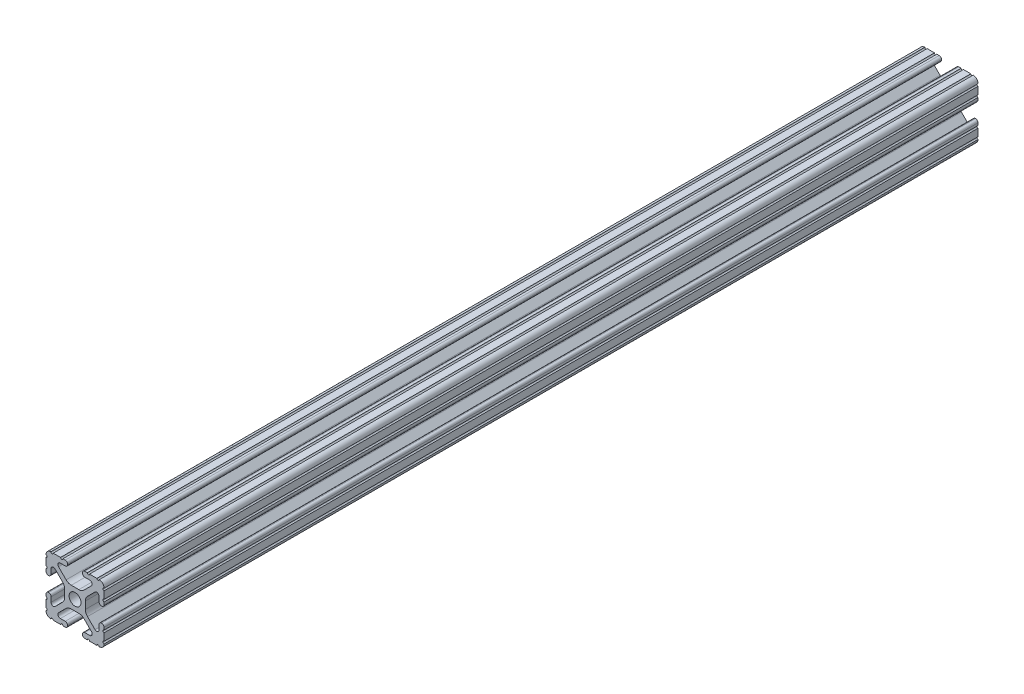
from build123d import *

# Parameters (mm, degrees)
SKETCH1_R           = 2.6035
BOSS_EXTRUDE1_DEPTH = 304.8
SKETCH2_W           = 33.577347781
SKETCH2_H           = 32.744851555
CUT_EXTRUDE1_DEPTH  = 227.33


with BuildPart() as part:
    # Sketch1 → Boss-Extrude1 (new, symmetric)
    with BuildSketch(Plane.XY):
        with BuildLine():
            Line((-7.179650497, -8.645192506), (-3.952270251, -5.423690499))
            ThreePointArc((-3.952270251, -5.423690499), (-2.922936451, -4.736929036), (-1.709253557, -4.4958))
            Line((-1.709253557, -4.4958), (1.709253557, -4.4958))
            ThreePointArc((1.709253557, -4.4958), (2.922936451, -4.736929036), (3.952270251, -5.423690499))
            Line((3.952270251, -5.423690499), (7.179650497, -8.645192506))
            ThreePointArc((7.179650497, -8.645192506), (7.41473083, -9.822813117), (6.416408329, -10.4902))
            Line((6.416408329, -10.4902), (4.287512407, -10.4902))
            ThreePointArc((4.287512407, -10.4902), (3.54574862, -10.79744862), (3.2385, -11.539212407))
            Line((3.2385, -11.539212407), (3.2385, -11.650987593))
            ThreePointArc((3.2385, -11.650987593), (3.54574862, -12.39275138), (4.287512407, -12.7))
            Line((4.287512407, -12.7), (5.317126718, -12.7))
            ThreePointArc((5.317126718, -12.7), (5.825126718, -12.192), (6.333126718, -12.7))
            Line((6.333126718, -12.7), (9.550443118, -12.7))
            ThreePointArc((9.550443118, -12.7), (10.058366869, -12.192000006), (10.566443095, -12.699847501))
            ThreePointArc((10.566443095, -12.699847501), (12.082537762, -12.08250727), (12.699846982, -10.566399977))
            ThreePointArc((12.699846982, -10.566399977), (12.192000006, -10.058323491), (12.7, -9.5504))
            Line((12.7, -9.5504), (12.7, -6.3330836))
            ThreePointArc((12.7, -6.3330836), (12.192, -5.8250836), (12.7, -5.3170836))
            Line((12.7, -5.3170836), (12.7, -4.287469289))
            ThreePointArc((12.7, -4.287469289), (12.39275138, -3.545705502), (11.650987593, -3.238456882))
            Line((11.650987593, -3.238456882), (11.539212407, -3.238456882))
            ThreePointArc((11.539212407, -3.238456882), (10.79744862, -3.545705502), (10.4902, -4.287469289))
            Line((10.4902, -4.287469289), (10.4902, -6.402089023))
            ThreePointArc((10.4902, -6.402089023), (9.856505071, -7.351067942), (8.737131347, -7.129408934))
            Line((8.737131347, -7.129408934), (5.441005833, -3.840816462))
            ThreePointArc((5.441005833, -3.840816462), (4.750877967, -2.809883091), (4.5085, -1.593185507))
            Line((4.5085, -1.593185507), (4.5085, 1.593185507))
            ThreePointArc((4.5085, 1.593185507), (4.750877967, 2.809883091), (5.441005833, 3.840816462))
            Line((5.441005833, 3.840816462), (8.737131347, 7.129408934))
            ThreePointArc((8.737131347, 7.129408934), (9.856505071, 7.351067942), (10.4902, 6.402089023))
            Line((10.4902, 6.402089023), (10.4902, 4.287469289))
            ThreePointArc((10.4902, 4.287469289), (10.79744862, 3.545705502), (11.539212407, 3.238456882))
            Line((11.539212407, 3.238456882), (11.650987593, 3.238456882))
            ThreePointArc((11.650987593, 3.238456882), (12.39275138, 3.545705502), (12.7, 4.287469289))
            Line((12.7, 4.287469289), (12.7, 5.3170836))
            ThreePointArc((12.7, 5.3170836), (12.192, 5.8250836), (12.7, 6.3330836))
            Line((12.7, 6.3330836), (12.7, 9.5504))
            ThreePointArc((12.7, 9.5504), (12.192000006, 10.058323491), (12.699846982, 10.566399977))
            ThreePointArc((12.699846982, 10.566399977), (12.082537762, 12.08250727), (10.566443095, 12.699847501))
            ThreePointArc((10.566443095, 12.699847501), (10.058366869, 12.192000006), (9.550443118, 12.7))
            Line((9.550443118, 12.7), (6.333126718, 12.7))
            ThreePointArc((6.333126718, 12.7), (5.825126718, 12.192), (5.317126718, 12.7))
            Line((5.317126718, 12.7), (4.287512407, 12.7))
            ThreePointArc((4.287512407, 12.7), (3.54574862, 12.39275138), (3.2385, 11.650987593))
            Line((3.2385, 11.650987593), (3.2385, 11.539212407))
            ThreePointArc((3.2385, 11.539212407), (3.54574862, 10.79744862), (4.287512407, 10.4902))
            Line((4.287512407, 10.4902), (6.476788598, 10.4902))
            ThreePointArc((6.476788598, 10.4902), (7.432222385, 9.85140422), (7.207036008, 8.724370562))
            Line((7.207036008, 8.724370562), (3.898272566, 5.423169045))
            ThreePointArc((3.898272566, 5.423169045), (2.869120213, 4.736787962), (1.655778399, 4.4958))
            Line((1.655778399, 4.4958), (-1.655778399, 4.4958))
            ThreePointArc((-1.655778399, 4.4958), (-2.869120213, 4.736787962), (-3.898272566, 5.423169045))
            Line((-3.898272566, 5.423169045), (-7.207036008, 8.724370562))
            ThreePointArc((-7.207036008, 8.724370562), (-7.432222385, 9.85140422), (-6.476788598, 10.4902))
            Line((-6.476788598, 10.4902), (-4.287512407, 10.4902))
            ThreePointArc((-4.287512407, 10.4902), (-3.54574862, 10.79744862), (-3.2385, 11.539212407))
            Line((-3.2385, 11.539212407), (-3.2385, 11.650987593))
            ThreePointArc((-3.2385, 11.650987593), (-3.54574862, 12.39275138), (-4.287512407, 12.7))
            Line((-4.287512407, 12.7), (-5.317126718, 12.7))
            ThreePointArc((-5.317126718, 12.7), (-5.825126718, 12.192), (-6.333126718, 12.7))
            Line((-6.333126718, 12.7), (-9.550443118, 12.7))
            ThreePointArc((-9.550443118, 12.7), (-10.058366869, 12.192000006), (-10.566443095, 12.699847501))
            ThreePointArc((-10.566443095, 12.699847501), (-12.082537762, 12.08250727), (-12.699846982, 10.566399977))
            ThreePointArc((-12.699846982, 10.566399977), (-12.192000006, 10.058323491), (-12.7, 9.5504))
            Line((-12.7, 9.5504), (-12.7, 6.3330836))
            ThreePointArc((-12.7, 6.3330836), (-12.192, 5.8250836), (-12.7, 5.3170836))
            Line((-12.7, 5.3170836), (-12.7, 4.287469289))
            ThreePointArc((-12.7, 4.287469289), (-12.39275138, 3.545705502), (-11.650987593, 3.238456882))
            Line((-11.650987593, 3.238456882), (-11.539212407, 3.238456882))
            ThreePointArc((-11.539212407, 3.238456882), (-10.79744862, 3.545705502), (-10.4902, 4.287469289))
            Line((-10.4902, 4.287469289), (-10.4902, 6.402089023))
            ThreePointArc((-10.4902, 6.402089023), (-9.856505071, 7.351067942), (-8.737131347, 7.129408934))
            Line((-8.737131347, 7.129408934), (-5.441005833, 3.840816462))
            ThreePointArc((-5.441005833, 3.840816462), (-4.750877967, 2.809883091), (-4.5085, 1.593185507))
            Line((-4.5085, 1.593185507), (-4.5085, -1.593185507))
            ThreePointArc((-4.5085, -1.593185507), (-4.750877967, -2.809883091), (-5.441005833, -3.840816462))
            Line((-5.441005833, -3.840816462), (-8.737131347, -7.129408934))
            ThreePointArc((-8.737131347, -7.129408934), (-9.856505071, -7.351067942), (-10.4902, -6.402089023))
            Line((-10.4902, -6.402089023), (-10.4902, -4.287469289))
            ThreePointArc((-10.4902, -4.287469289), (-10.79744862, -3.545705502), (-11.539212407, -3.238456882))
            Line((-11.539212407, -3.238456882), (-11.650987593, -3.238456882))
            ThreePointArc((-11.650987593, -3.238456882), (-12.39275138, -3.545705502), (-12.7, -4.287469289))
            Line((-12.7, -4.287469289), (-12.7, -5.3170836))
            ThreePointArc((-12.7, -5.3170836), (-12.192, -5.8250836), (-12.7, -6.3330836))
            Line((-12.7, -6.3330836), (-12.7, -9.5504))
            ThreePointArc((-12.7, -9.5504), (-12.192000006, -10.058323491), (-12.699846982, -10.566399977))
            ThreePointArc((-12.699846982, -10.566399977), (-12.082537762, -12.08250727), (-10.566443095, -12.699847501))
            ThreePointArc((-10.566443095, -12.699847501), (-10.058366869, -12.192000006), (-9.550443118, -12.7))
            Line((-9.550443118, -12.7), (-6.333126718, -12.7))
            ThreePointArc((-6.333126718, -12.7), (-5.825126718, -12.192), (-5.317126718, -12.7))
            Line((-5.317126718, -12.7), (-4.287512407, -12.7))
            ThreePointArc((-4.287512407, -12.7), (-3.54574862, -12.39275138), (-3.2385, -11.650987593))
            Line((-3.2385, -11.650987593), (-3.2385, -11.539212407))
            ThreePointArc((-3.2385, -11.539212407), (-3.54574862, -10.79744862), (-4.287512407, -10.4902))
            Line((-4.287512407, -10.4902), (-6.416408329, -10.4902))
            ThreePointArc((-6.416408329, -10.4902), (-7.41473083, -9.822813117), (-7.179650497, -8.645192506))
        make_face()
        with Locations(Location((0, 0, 0), (0, 0, 180))):
            Circle(SKETCH1_R, mode=Mode.SUBTRACT)
    extrude(amount=BOSS_EXTRUDE1_DEPTH, both=True)

    # Sketch2 → Cut-Extrude1 (cut)
    with BuildSketch(Plane.XY.offset(304.8)):
        with Locations((0.601247275, -1.572492872)):
            Rectangle(SKETCH2_W, SKETCH2_H)
    extrude(amount=-CUT_EXTRUDE1_DEPTH, mode=Mode.SUBTRACT)


solid = part.part
